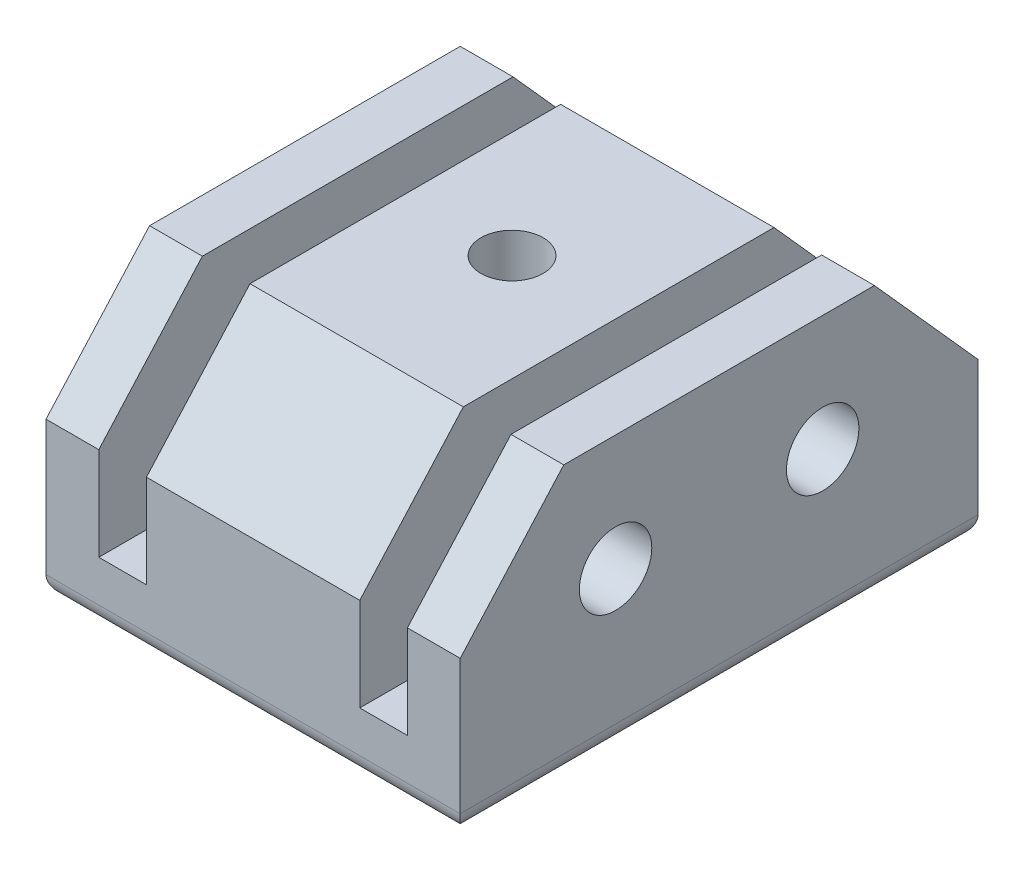
from build123d import *

# Parameters (mm, degrees)
SKETCH1_W           = 63.5
SKETCH1_H           = 6.35
BOSS_EXTRUDE1_DEPTH = 50.8
BOSS_EXTRUDE2_DEPTH = 50.8
SKETCH10_W          = 5.842
SKETCH10_H          = 25.629031657
CUT_EXTRUDE1_DEPTH  = 88.854357354
SKETCH11_R          = 4.445
CUT_EXTRUDE2_DEPTH  = 88.854357354
FILLET1_R           = 2.54
SKETCH24_R          = 3.81
CUT_EXTRUDE10_DEPTH = 88.854357354
CUT_EXTRUDE11_DEPTH = 6.35


with BuildPart() as part:
    # Sketch1 → Boss-Extrude1 (new body)
    with BuildSketch(Plane(origin=(0, 0, 0), x_dir=(0, 0, -1), z_dir=(1, 0, 0))):
        with Locations((31.75, 3.175)):
            Rectangle(SKETCH1_W, SKETCH1_H)
    extrude(amount=-BOSS_EXTRUDE1_DEPTH)

    # Sketch2 → Boss-Extrude2 (add)
    with BuildSketch(Plane(origin=(0, 0, 0), x_dir=(0, 0, -1), z_dir=(1, 0, 0))):
        Polygon((0, 6.35), (0, 19.05), (12.7, 33.249031657), (50.8, 33.249031657), (63.5, 19.05), (63.5, 6.35), align=None)
    extrude(amount=-BOSS_EXTRUDE2_DEPTH)

    # Sketch10 → Cut-Extrude1 (cut, through all)
    with BuildSketch(Plane(origin=(0, 0, -63.5), x_dir=(-1, 0, 0), z_dir=(0, 0, -1))):
        with Locations((9.398, 20.434515829)):
            Rectangle(SKETCH10_W, SKETCH10_H)
        with Locations((41.402, 20.434515829)):
            Rectangle(SKETCH10_W, SKETCH10_H)
    extrude(amount=-CUT_EXTRUDE1_DEPTH, mode=Mode.SUBTRACT)

    # Sketch11 → Cut-Extrude2 (cut, through all)
    with BuildSketch(Plane(origin=(0, 0, 0), x_dir=(0, 0, -1), z_dir=(1, 0, 0))):
        with Locations((19.05, 19.05)):
            Circle(SKETCH11_R)
        with Locations((44.45, 19.05)):
            Circle(SKETCH11_R)
    extrude(amount=-CUT_EXTRUDE2_DEPTH, mode=Mode.SUBTRACT)

    # Fillet1
    fillet1_edges = [part.edges().sort_by_distance(p)[0] for p in [
        (0, 0, -31.75),
        (-50.8, 0, -31.75),
        (-25.4, 0, -63.5),
        (-25.4, 0, 0),
    ]]
    fillet(fillet1_edges, radius=FILLET1_R)

    # Sketch24 → Cut-Extrude10 (cut, through all)
    with BuildSketch(Plane.XZ):
        with Locations(Location((-25.4, -31.75, 0), (0, 0, 270))):
            Circle(SKETCH24_R)
    extrude(amount=-CUT_EXTRUDE10_DEPTH, mode=Mode.SUBTRACT)

    # Sketch25 → Cut-Extrude11 (cut)
    with BuildSketch(Plane.XZ):
        Polygon((-29.359468146, -24.892), (-33.318936292, -31.75), (-29.359468146, -38.608), (-21.440531854, -38.608), (-17.481063708, -31.75), (-21.440531854, -24.892), align=None)
    extrude(amount=-CUT_EXTRUDE11_DEPTH, mode=Mode.SUBTRACT)


solid = part.part
